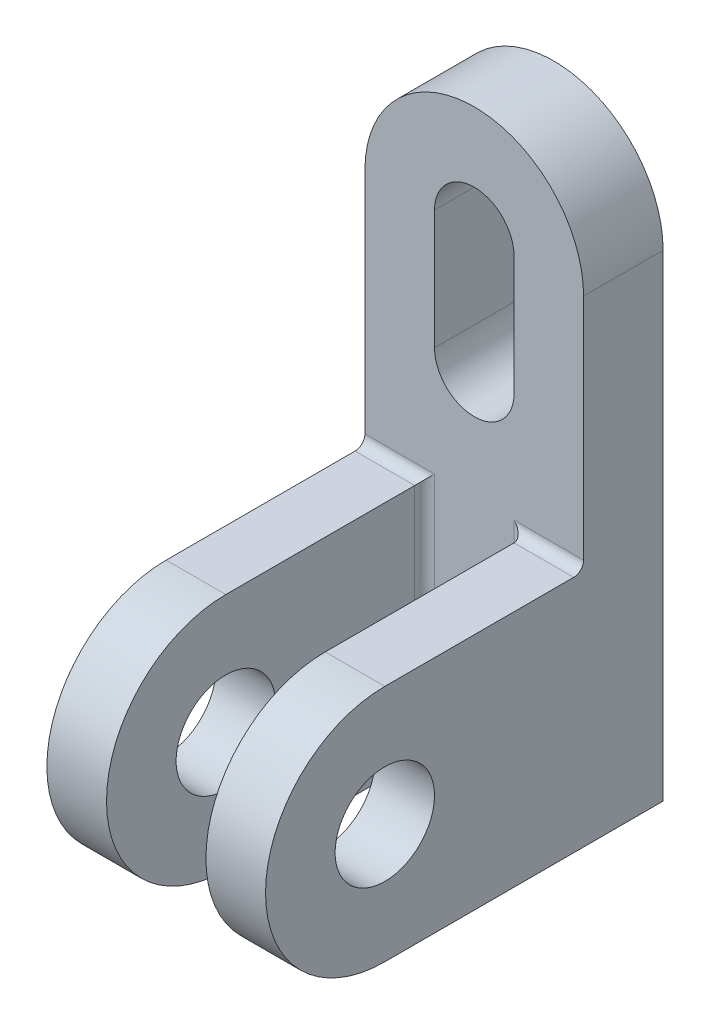
from build123d import *

# Parameters (mm, degrees)
ESQUISSE1_R             = 22
BOSS_EXTRU_1_DEPTH      = 16
ENL_V_MAT_EXTRU_1_DEPTH = 16
BOSS_EXTRU_3_DEPTH      = 12
CONG_2_R                = 2


with BuildPart() as part:
    # Esquisse1 → Boss.-Extru.1 (new body)
    with BuildSketch(Plane(origin=(0, 0, 0), x_dir=(0, 1, 0), z_dir=(0, 0, 1))):
        with BuildLine():
            Line((-59, 22), (-59, -22))
            Line((-59, -22), (37, -22))
            ThreePointArc((37, -22), (15, 0), (37, 22))
            Line((37, 22), (-59, 22))
        make_face()
        with Locations((37, 0)):
            Circle(ESQUISSE1_R)
    extrude(amount=BOSS_EXTRU_1_DEPTH)

    # Esquisse2 → Enlèv. mat.-Extru.1 (cut)
    with BuildSketch(Plane(origin=(0, 0, 0), x_dir=(1, 0, 0), z_dir=(0, 0, -1))):
        with BuildLine():
            Line((-8, -37), (-8, -13))
            ThreePointArc((-8, -13), (0, -5), (8, -13))
            Line((8, -13), (8, -37))
            ThreePointArc((8, -37), (0, -45), (-8, -37))
        make_face()
    extrude(amount=-ENL_V_MAT_EXTRU_1_DEPTH, mode=Mode.SUBTRACT)

    # Esquisse3 → Boss.-Extru.3 (add)
    with BuildSketch(Plane.YZ.offset(22)):
        with BuildLine():
            Line((-59, 56), (-59, 16))
            Line((-59, 16), (-11, 16))
            Line((-11, 16), (-11, 56))
            ThreePointArc((-11, 56), (-35, 32), (-59, 56))
        make_face()
        with BuildLine():
            ThreePointArc((-11, 56), (-35, 80), (-59, 56))
            Line((-59, 56), (-45, 56))
            ThreePointArc((-45, 56), (-35, 66), (-25, 56))
            Line((-25, 56), (-11, 56))
        make_face()
        with BuildLine():
            Line((-45, 56), (-59, 56))
            ThreePointArc((-59, 56), (-35, 32), (-11, 56))
            Line((-11, 56), (-25, 56))
            ThreePointArc((-25, 56), (-35, 46), (-45, 56))
        make_face()
    boss_extru_3 = extrude(amount=-BOSS_EXTRU_3_DEPTH)

    # Symétrie1: Boss.-Extru.3 across plane
    add(boss_extru_3.mirror(Plane(origin=(0, 0, 0), x_dir=(0, 0, 1), z_dir=(1, 0, 0))))

    # Congé2
    cong_2_edges = [part.edges().sort_by_distance(p)[0] for p in [
        (16, -11, 16),
        (10, -35, 16),
        (-16, -11, 16),
        (-10, -35, 16),
    ]]
    fillet(cong_2_edges, radius=CONG_2_R)


solid = part.part
